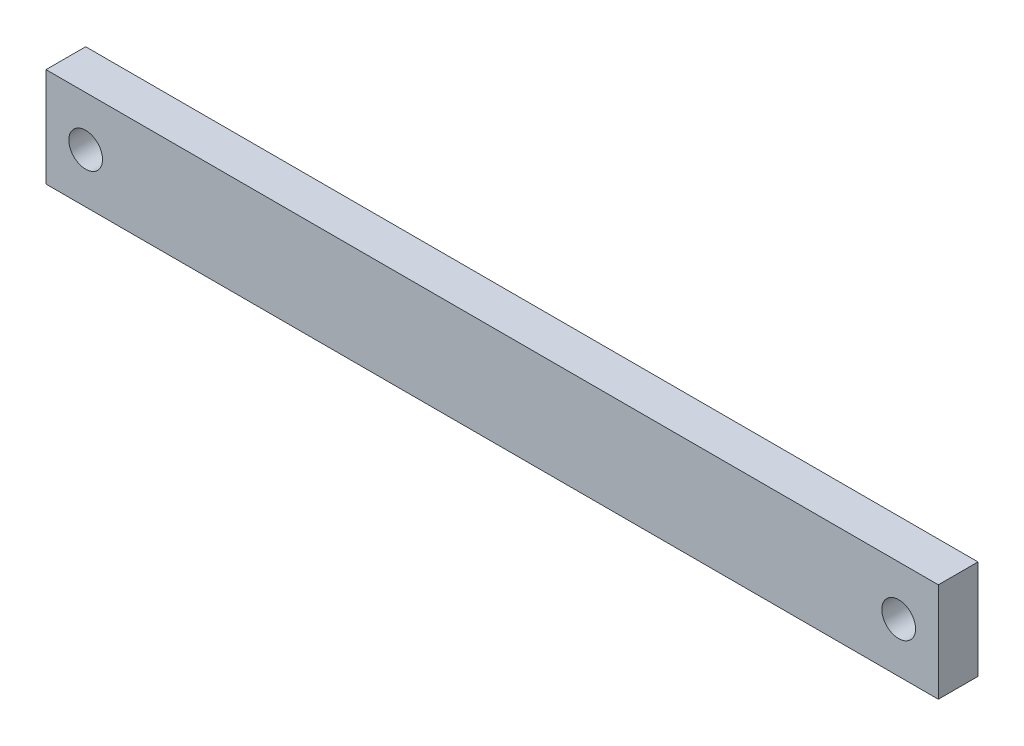
from build123d import *

# Parameters (mm, degrees)
BATTERY_REMOVABLE_CLAMP_BAR_START = 43
SKETCH_1_W                        = 90
SKETCH_1_H                        = 10
BATTERY_REMOVABLE_CLAMP_BAR_DEPTH = 4
CLAMP_TWO_M3_START                = 48
SKETCH_2_R                        = 1.7
CLAMP_TWO_M3_DEPTH                = 6


with BuildPart() as part:
    # 草图1 → Battery_removable_clamp_bar (new body)
    with BuildSketch(Plane.XY.offset(BATTERY_REMOVABLE_CLAMP_BAR_START)):
        with Locations((6, 0)):
            Rectangle(SKETCH_1_W, SKETCH_1_H)
    extrude(amount=BATTERY_REMOVABLE_CLAMP_BAR_DEPTH)

    # 草图2 → Clamp_two_M3 (cut)
    with BuildSketch(Plane.XY.offset(CLAMP_TWO_M3_START)):
        with Locations(Location((-35, 0, 0), (0, 0, 180))):
            Circle(SKETCH_2_R)
        with Locations(Location((47, 0, 0), (0, 0, 180))):
            Circle(SKETCH_2_R)
    extrude(amount=-CLAMP_TWO_M3_DEPTH, mode=Mode.SUBTRACT)


solid = part.part
